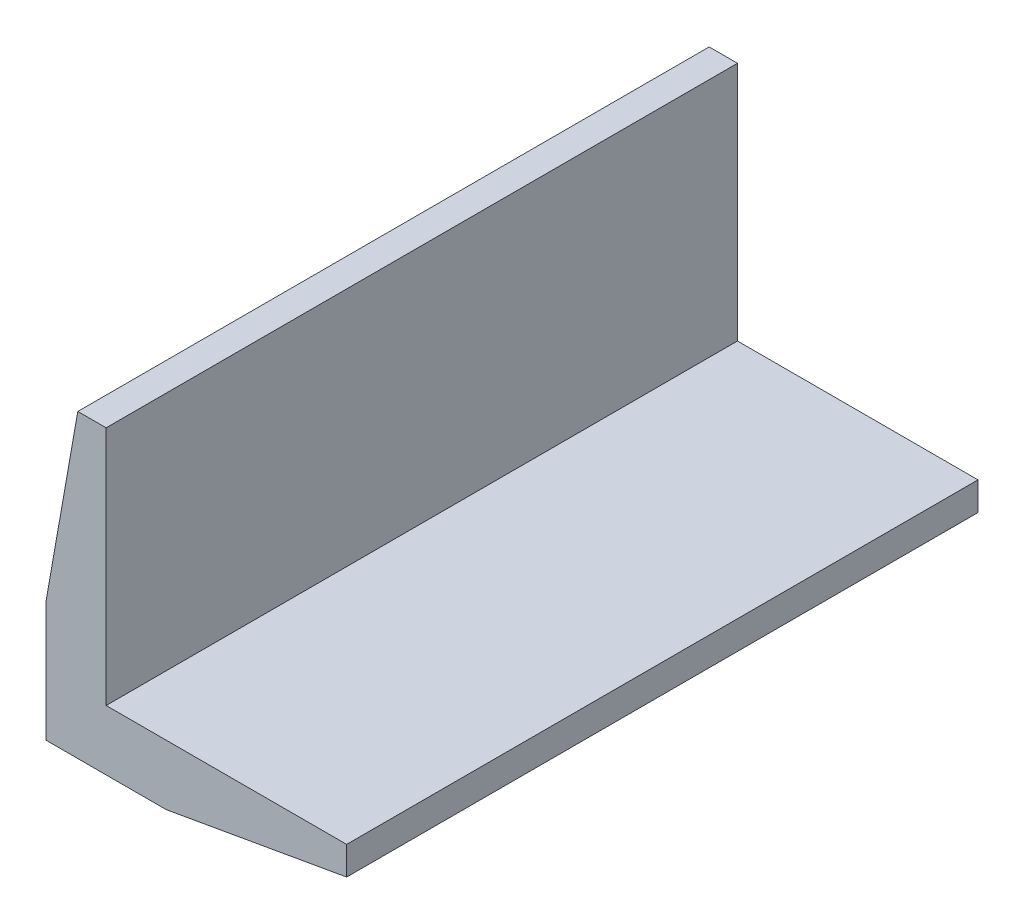
from build123d import *

# Parameters (mm, degrees)
BOSS_EXTRUDE1_DEPTH     = 42
CUT_EXTRUDE1_DEPTH      = 51.635955605
CUT_EXTRUDE1_DEPTH_BACK = 51.635955605
SKETCH2_R               = 1.125
CHAMFER1_SIZE           = 12
CHAMFER1_SIZE2          = 2.115923769
CHAMFER2_SIZE           = 12
CHAMFER2_SIZE2          = 2.115923769


with BuildPart() as part:
    # Sketch1 → Boss-Extrude1 (new body)
    with BuildSketch(Plane.XY):
        Polygon((0, 0), (0, 20), (4, 20), (4, 4), (20, 4), (20, 0), align=None)
    extrude(amount=BOSS_EXTRUDE1_DEPTH)

    # Sketch2 → Cut-Extrude1 (cut, two sides: drawn at the far end of the back side and taken through both)
    with BuildSketch(Plane(origin=(0, 0, 0), x_dir=(0, 0, -1), z_dir=(0.7071067811865475, -0.7071067811865477, 0)).offset(-CUT_EXTRUDE1_DEPTH_BACK)):
        with Locations(Location((-40, 2.828427125, 0), (0, 0, 90))):
            Circle(SKETCH2_R)
        with Locations(Location((-37.285714286, 2.828427125, 0), (0, 0, 90))):
            Circle(SKETCH2_R)
        with Locations(Location((-34.571428571, 2.828427125, 0), (0, 0, 90))):
            Circle(SKETCH2_R)
        with Locations(Location((-31.857142857, 2.828427125, 0), (0, 0, 90))):
            Circle(SKETCH2_R)
        with Locations(Location((-29.142857143, 2.828427125, 0), (0, 0, 90))):
            Circle(SKETCH2_R)
        with Locations(Location((-26.428571429, 2.828427125, 0), (0, 0, 90))):
            Circle(SKETCH2_R)
        with Locations(Location((-23.714285714, 2.828427125, 0), (0, 0, 90))):
            Circle(SKETCH2_R)
        with Locations(Location((-21, 2.828427125, 0), (0, 0, 90))):
            Circle(SKETCH2_R)
        with Locations(Location((-18.285714286, 2.828427125, 0), (0, 0, 90))):
            Circle(SKETCH2_R)
        with Locations(Location((-15.571428571, 2.828427125, 0), (0, 0, 90))):
            Circle(SKETCH2_R)
        with Locations(Location((-12.857142857, 2.828427125, 0), (0, 0, 90))):
            Circle(SKETCH2_R)
        with Locations(Location((-10.142857143, 2.828427125, 0), (0, 0, 90))):
            Circle(SKETCH2_R)
        with Locations(Location((-7.428571429, 2.828427125, 0), (0, 0, 90))):
            Circle(SKETCH2_R)
        with Locations(Location((-4.714285714, 2.828427125, 0), (0, 0, 90))):
            Circle(SKETCH2_R)
        with Locations(Location((-2, 2.828427125, 0), (0, 0, 90))):
            Circle(SKETCH2_R)
    extrude(amount=CUT_EXTRUDE1_DEPTH + CUT_EXTRUDE1_DEPTH_BACK, mode=Mode.SUBTRACT)

    # Chamfer1
    chamfer1_edges = [part.edges().sort_by_distance(p)[0] for p in [
        (20, 0, 21),
    ]]
    chamfer1_side = [part.faces().sort_by_distance(p)[0] for p in [
        (10.669713524, 0, 21),
    ]]
    chamfer(chamfer1_edges, length=CHAMFER1_SIZE, length2=CHAMFER1_SIZE2, reference=chamfer1_side[0])

    # Chamfer2
    chamfer2_edges = [part.edges().sort_by_distance(p)[0] for p in [
        (0, 20, 21),
    ]]
    chamfer2_side = [part.faces().sort_by_distance(p)[0] for p in [
        (0, 10.669713524, 21),
    ]]
    chamfer(chamfer2_edges, length=CHAMFER2_SIZE, length2=CHAMFER2_SIZE2, reference=chamfer2_side[0])


solid = part.part
